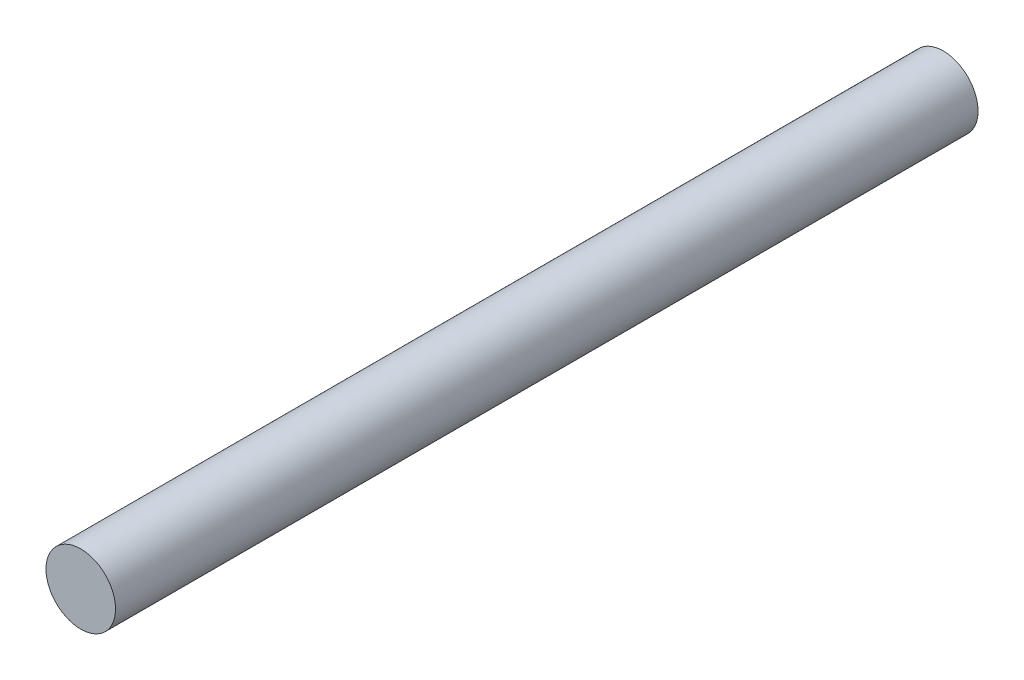
from build123d import *

# Parameters (mm, degrees)
SKETCH1_R           = 1
BOSS_EXTRUDE1_DEPTH = 24.8


with BuildPart() as part:
    # Sketch1 → Boss-Extrude1 (new body)
    with BuildSketch(Plane.XY):
        with Locations(Location((0, 0, 0), (0, 0, 180))):
            Circle(SKETCH1_R)
    extrude(amount=BOSS_EXTRUDE1_DEPTH)


solid = part.part
